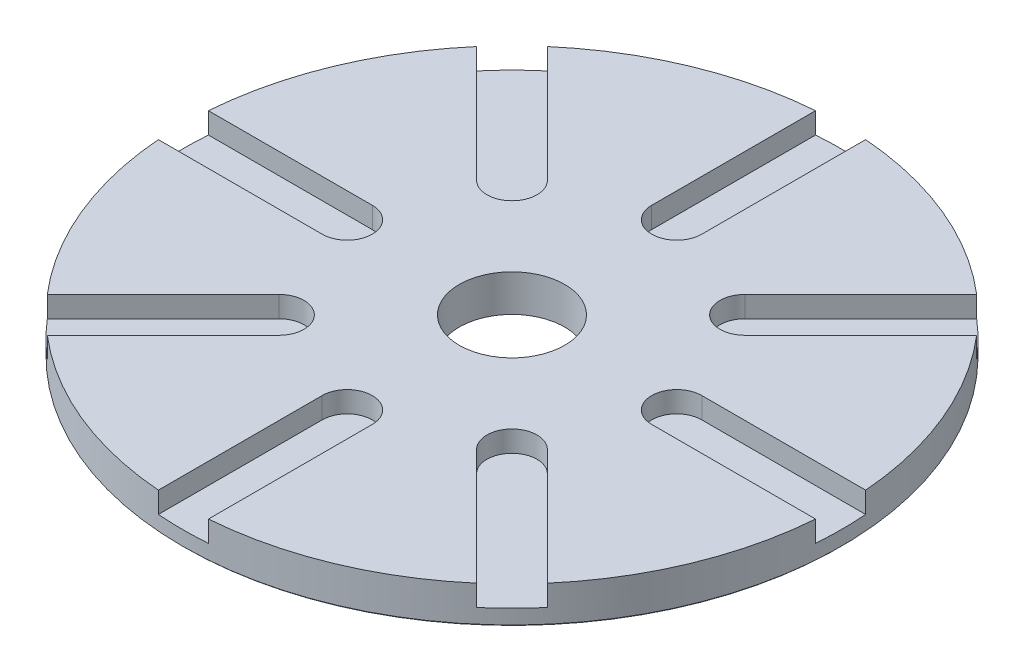
from build123d import *

# Parameters (mm, degrees)
SKETCH_1_R               = 250
EXTRUDE_1_DEPTH          = 50
CHAMFER_1_SIZE           = 1
CUT_EXTRUDE_1_DEPTH      = 22
CUT_EXTRUDE_2_DEPTH      = 16
CUT_EXTRUDE_3_DEPTH      = 22
CUT_EXTRUDE_4_DEPTH      = 16
PATTERN_CIRCULAR_1_COUNT = 4
SKETCH_6_R               = 60
CUT_EXTRUDE_5_DEPTH      = 20
SKETCH_22_R              = 40
CUT_EXTRUDE_13_DEPTH     = 355.823899984


with BuildPart() as part:
    # 草图1 → 凸台-拉伸1 (new body)
    with BuildSketch(Plane(origin=(0, 0, 0), x_dir=(1, 0, 0), z_dir=(0, 1, 0))):
        Circle(SKETCH_1_R)
    extrude(amount=EXTRUDE_1_DEPTH)

    # 倒角1
    chamfer_1_edges = [part.edges().sort_by_distance(p)[0] for p in [
        (-250, 0, 0),
        (-250, 50, 0),
    ]]
    chamfer(chamfer_1_edges, length=CHAMFER_1_SIZE)

    # 草图2 → 切除-拉伸1 (cut)
    with BuildSketch(Plane(origin=(0, 50, 0), x_dir=(1, 0, 0), z_dir=(0, 1, 0))):
        with BuildLine():
            Line((125, 11), (250, 11))
            Line((250, 11), (250, -11))
            Line((250, -11), (125, -11))
            ThreePointArc((125, -11), (114, 0), (125, 11))
        make_face()
    cut_extrude_1 = extrude(amount=-CUT_EXTRUDE_1_DEPTH, mode=Mode.SUBTRACT)

    # 草图3 → 切除-拉伸2 (cut)
    with BuildSketch(Plane(origin=(0, 28, 0), x_dir=(1, 0, 0), z_dir=(0, 1, 0))):
        with BuildLine():
            Line((250, 19), (250, -19))
            Line((250, -19), (125, -19))
            ThreePointArc((125, -19), (106, 0), (125, 19))
            Line((125, 19), (250, 19))
        make_face()
    cut_extrude_2 = extrude(amount=-CUT_EXTRUDE_2_DEPTH, mode=Mode.SUBTRACT)

    # 草图4 → 切除-拉伸3 (cut)
    with BuildSketch(Plane(origin=(0, 50, 0), x_dir=(1, 0, 0), z_dir=(0, 1, 0))):
        with BuildLine():
            Line((168.998520704, 184.55486989), (184.55486989, 168.998520704))
            Line((184.55486989, 168.998520704), (96.166522241, 80.610173055))
            ThreePointArc((96.166522241, 80.610173055), (80.610173055, 80.610173055), (80.610173055, 96.166522241))
            Line((80.610173055, 96.166522241), (168.998520704, 184.55486989))
        make_face()
    cut_extrude_3 = extrude(amount=-CUT_EXTRUDE_3_DEPTH, mode=Mode.SUBTRACT)

    # 草图5 → 切除-拉伸4 (cut)
    with BuildSketch(Plane(origin=(0, 28, 0), x_dir=(1, 0, 0), z_dir=(0, 1, 0))):
        with BuildLine():
            Line((163.341666454, 190.211724139), (190.211724139, 163.341666454))
            Line((190.211724139, 163.341666454), (101.823376491, 74.953318806))
            ThreePointArc((101.823376491, 74.953318806), (74.953318806, 74.953318806), (74.953318806, 101.823376491))
            Line((74.953318806, 101.823376491), (163.341666454, 190.211724139))
        make_face()
    cut_extrude_4 = extrude(amount=-CUT_EXTRUDE_4_DEPTH, mode=Mode.SUBTRACT)

    # 阵列(圆周)1: 切除-拉伸1, 切除-拉伸2, 切除-拉伸3, 切除-拉伸4 ×4 about axis
    pattern_circular_1_axis = Axis((0, 50, 0), (0, -1, 0))
    add([cut_extrude_1.rotate(pattern_circular_1_axis, i * 360 / PATTERN_CIRCULAR_1_COUNT) for i in range(1, PATTERN_CIRCULAR_1_COUNT)], mode=Mode.SUBTRACT)
    add([cut_extrude_2.rotate(pattern_circular_1_axis, i * 360 / PATTERN_CIRCULAR_1_COUNT) for i in range(1, PATTERN_CIRCULAR_1_COUNT)], mode=Mode.SUBTRACT)
    add([cut_extrude_3.rotate(pattern_circular_1_axis, i * 360 / PATTERN_CIRCULAR_1_COUNT) for i in range(1, PATTERN_CIRCULAR_1_COUNT)], mode=Mode.SUBTRACT)
    add([cut_extrude_4.rotate(pattern_circular_1_axis, i * 360 / PATTERN_CIRCULAR_1_COUNT) for i in range(1, PATTERN_CIRCULAR_1_COUNT)], mode=Mode.SUBTRACT)

    # 草图6 → 切除-拉伸5 (cut)
    with BuildSketch(Plane(origin=(0, 50, 0), x_dir=(1, 0, 0), z_dir=(0, 1, 0))):
        Circle(SKETCH_6_R)
    extrude(amount=-CUT_EXTRUDE_5_DEPTH, mode=Mode.SUBTRACT)

    # 草图22 → 切除-拉伸13 (cut, through all)
    with BuildSketch(Plane(origin=(0, 30, 0), x_dir=(1, 0, 0), z_dir=(0, 1, 0))):
        Circle(SKETCH_22_R)
    extrude(amount=-CUT_EXTRUDE_13_DEPTH, mode=Mode.SUBTRACT)


with BuildPart() as body_2:
    # Split Bodies 2: the piece on the far side of the plane
    add(part.part)
    split(bisect_by=Plane(origin=(0, 28, 0), x_dir=(0, 0, -1), z_dir=(0, -1, 0)), keep=Keep.BOTTOM)


with BuildPart() as part_1:
    add(part.part)

    # Split Bodies 2
    split(bisect_by=Plane(origin=(0, 28, 0), x_dir=(0, 0, -1), z_dir=(0, -1, 0)), keep=Keep.TOP)


solid = part_1.part
